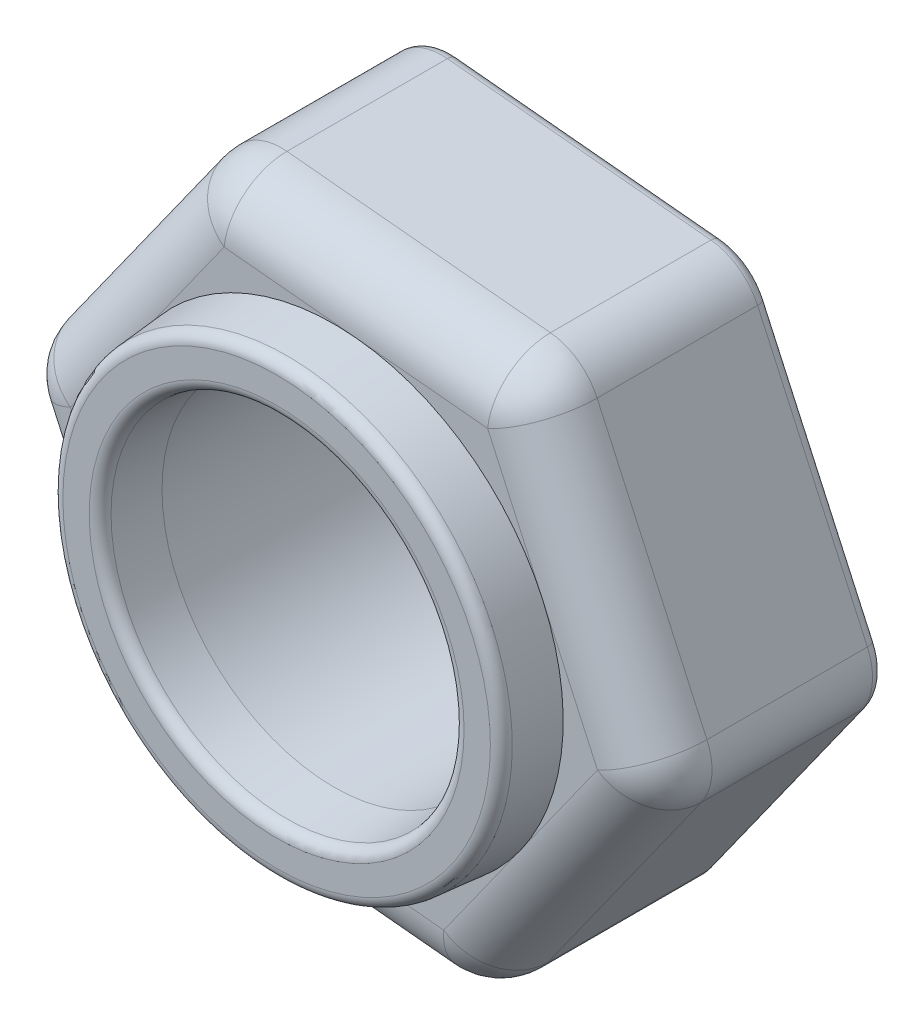
from build123d import *

# Parameters (mm, degrees)
SKETCH1_R           = 1.5
BOSS_EXTRUDE1_DEPTH = 2
FILLET1_R           = 0.5
SKETCH3_R           = 2
SKETCH3_R_2         = 1.5
BOSS_EXTRUDE2_DEPTH = 0.5
BOSS_EXTRUDE2_DRAFT = 5
FILLET2_R           = 0.1


with BuildPart() as part:
    # Sketch1 → Boss-Extrude1 (new body)
    with BuildSketch(Plane.XY):
        with BuildLine():
            Line((2.753751395, -0.013659805), (1.795799026, 2.087687523))
            ThreePointArc((1.795799026, 2.087687523), (1.631145222, 2.287378341), (1.388705435, 2.377988761))
            Line((1.388705435, 2.377988761), (-0.910090917, 2.599051338))
            ThreePointArc((-0.910090917, 2.599051338), (-1.165355141, 2.55630237), (-1.365045959, 2.391648566))
            Line((-1.365045959, 2.391648566), (-2.705889943, 0.511363815))
            ThreePointArc((-2.705889943, 0.511363815), (-2.796500362, 0.268924029), (-2.753751395, 0.013659805))
            Line((-2.753751395, 0.013659805), (-1.795799026, -2.087687523))
            ThreePointArc((-1.795799026, -2.087687523), (-1.631145222, -2.287378341), (-1.388705435, -2.377988761))
            Line((-1.388705435, -2.377988761), (0.910090917, -2.599051338))
            ThreePointArc((0.910090917, -2.599051338), (1.165355141, -2.55630237), (1.365045959, -2.391648566))
            Line((1.365045959, -2.391648566), (2.705889943, -0.511363815))
            ThreePointArc((2.705889943, -0.511363815), (2.796500362, -0.268924029), (2.753751395, -0.013659805))
        make_face()
        Circle(SKETCH1_R, mode=Mode.SUBTRACT)
    extrude(amount=BOSS_EXTRUDE1_DEPTH)

    # Fillet1
    fillet1_edges = [part.edges().sort_by_distance(p)[0] for p in [
        (1.165355141, -2.55630237, 2),
        (2.035467951, -1.45150619, 2),
        (2.796500362, -0.268924029, 2),
        (2.27477521, 1.037013859, 2),
        (1.631145222, 2.287378341, 2),
        (0.239307259, 2.488520049, 2),
        (-1.165355141, 2.55630237, 2),
        (-2.035467951, 1.45150619, 2),
        (-2.796500362, 0.268924029, 2),
        (-2.27477521, -1.037013859, 2),
        (-1.631145222, -2.287378341, 2),
        (-0.239307259, -2.488520049, 2),
    ]]
    fillet(fillet1_edges, radius=FILLET1_R)


with BuildPart() as boss_extrude2_tool:
    # Sketch3 → Boss-Extrude2 (with draft: the straight prism first)
    with BuildSketch(Plane.XY.offset(2)):
        Circle(SKETCH3_R)
        Circle(SKETCH3_R_2, mode=Mode.SUBTRACT)
    extrude(amount=BOSS_EXTRUDE2_DEPTH)
    # Boss-Extrude2: the draft: its side faces are tilted about the plane it starts from
    boss_extrude2_sides = [boss_extrude2_tool.faces().sort_by_distance(p)[0] for p in [
        (-2, 0, 2.25),
        (-1.5, 0, 2.25),
    ]]
    draft(boss_extrude2_sides, Plane.XY.offset(2), BOSS_EXTRUDE2_DRAFT)


with BuildPart() as part_1:
    add(part.part)

    # Boss-Extrude2: add boss_extrude2_tool
    add(boss_extrude2_tool.part)

    # Fillet2
    fillet2_edges = [part_1.edges().sort_by_distance(p)[0] for p in [
        (-2.27477521, -1.037013859, 0),
        (-2.796500362, 0.268924029, 0),
        (-2.035467951, 1.45150619, 0),
        (-1.165355141, 2.55630237, 0),
        (0.239307259, 2.488520049, 0),
        (1.631145222, 2.287378341, 0),
        (2.27477521, 1.037013859, 0),
        (2.796500362, -0.268924029, 0),
        (2.035467951, -1.45150619, 0),
        (1.165355141, -2.55630237, 0),
        (-0.239307259, -2.488520049, 0),
        (-1.631145222, -2.287378341, 0),
        (-1.956255668, 0, 2.5),
        (-1.543744332, 0, 2.5),
    ]]
    fillet(fillet2_edges, radius=FILLET2_R)


solid = part_1.part
